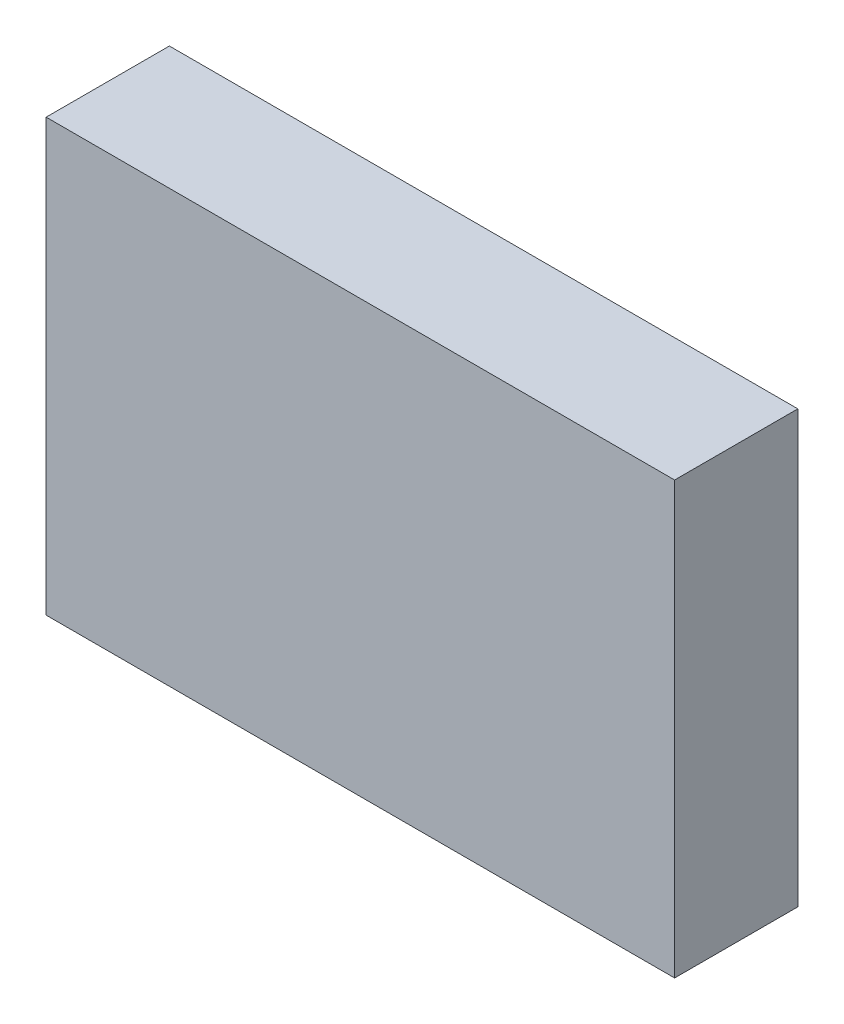
from build123d import *

# Parameters (mm, degrees)
SKETCH1_W           = 25.5
SKETCH1_H           = 17.5
BOSS_EXTRUDE1_DEPTH = 5


with BuildPart() as part:
    # Sketch1 → Boss-Extrude1 (new body)
    with BuildSketch(Plane.XY):
        with Locations((12.75, -8.75)):
            Rectangle(SKETCH1_W, SKETCH1_H)
    extrude(amount=BOSS_EXTRUDE1_DEPTH)


solid = part.part
